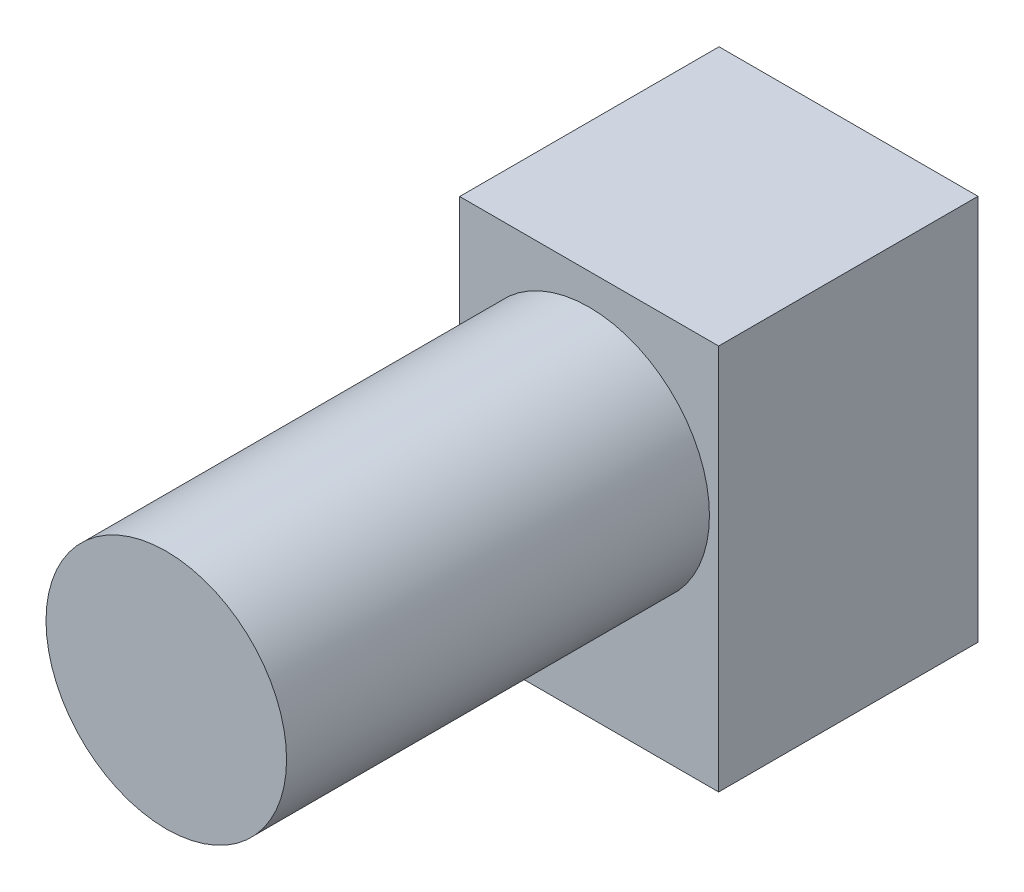
from build123d import *

# Parameters (mm, degrees)
SKETCH1_W      = 7
SKETCH1_H      = 10.44
EXTRUDE1_DEPTH = 7.0104
SKETCH2_R      = 3.2512
EXTRUDE2_DEPTH = 11.43


with BuildPart() as part:
    # Sketch1 → Extrude1 (new body)
    with BuildSketch(Plane.XY):
        Rectangle(SKETCH1_W, SKETCH1_H)
    extrude(amount=EXTRUDE1_DEPTH)

    # Sketch2 → Extrude2 (add)
    with BuildSketch(Plane.XY.offset(7.0104)):
        with Locations(Location((0, 1.13, 0), (0, 0, 180))):
            Circle(SKETCH2_R)
    extrude(amount=EXTRUDE2_DEPTH)


solid = part.part
